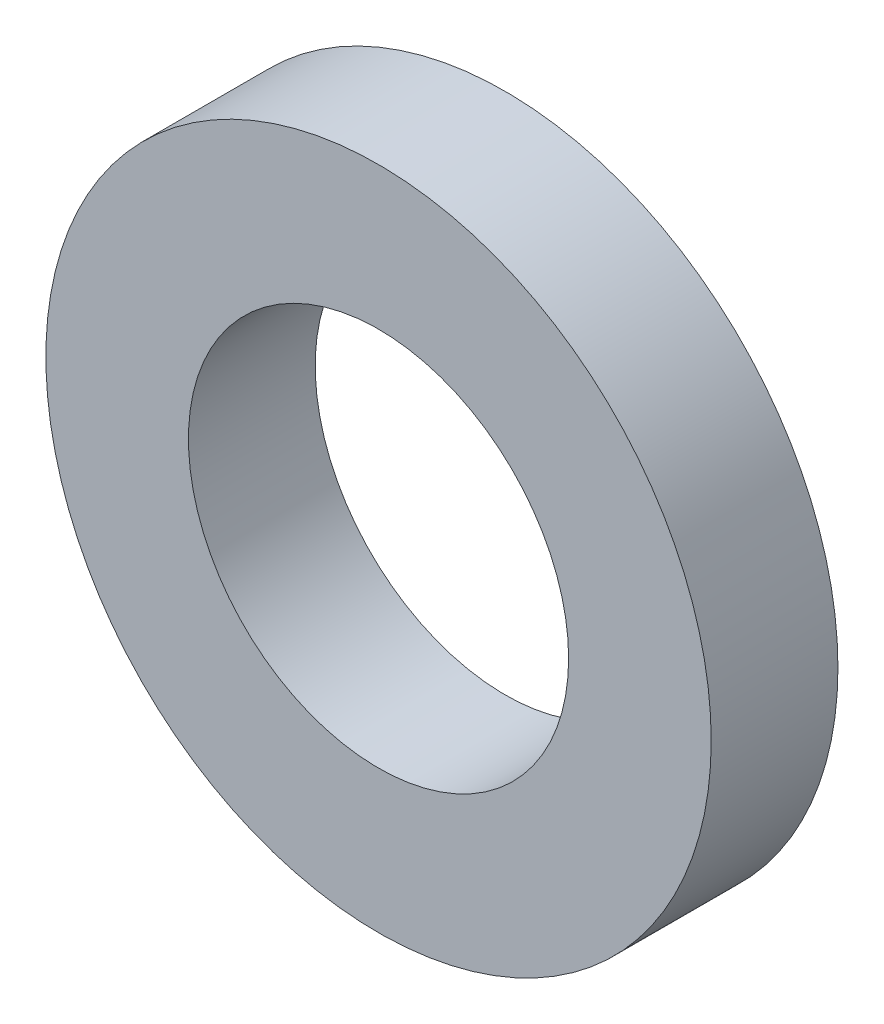
from build123d import *

# Parameters (mm, degrees)
SKETCH1_R           = 5.25
BOSS_EXTRUDE1_DEPTH = 2
SKETCH2_R           = 3
CUT_EXTRUDE1_DEPTH  = 2


with BuildPart() as part:
    # Sketch1 → Boss-Extrude1 (new body)
    with BuildSketch(Plane.XY):
        Circle(SKETCH1_R)
    extrude(amount=BOSS_EXTRUDE1_DEPTH)

    # Sketch2 → Cut-Extrude1 (cut)
    with BuildSketch(Plane.XY.offset(2)):
        Circle(SKETCH2_R)
    extrude(amount=-CUT_EXTRUDE1_DEPTH, mode=Mode.SUBTRACT)


solid = part.part
